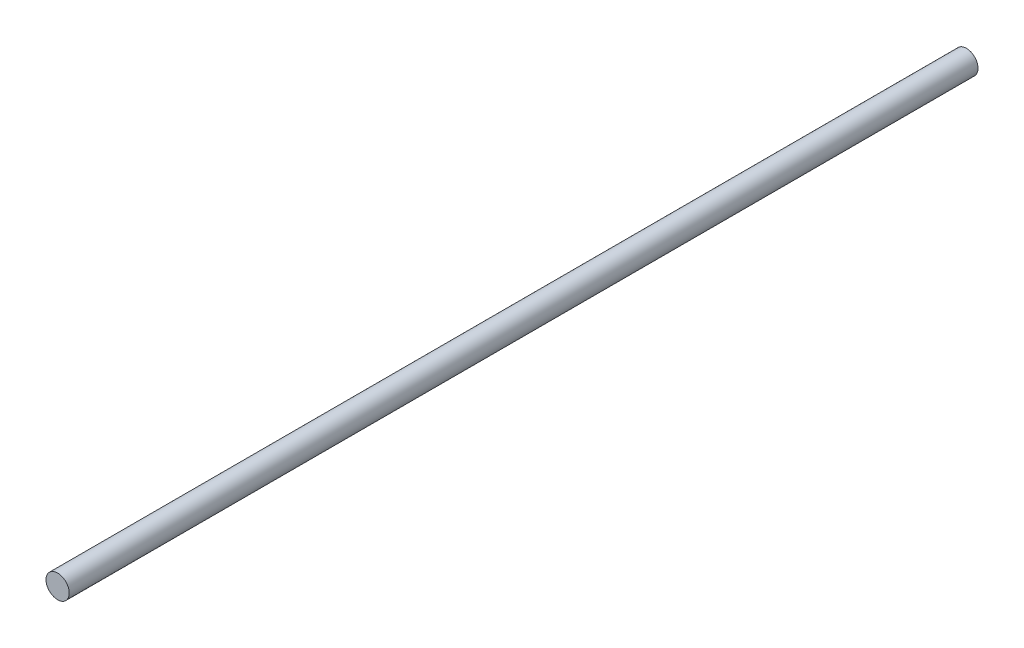
from build123d import *

# Parameters (mm, degrees)
SKETCH1_R           = 3
BOSS_EXTRUDE1_DEPTH = 235


with BuildPart() as part:
    # Sketch1 → Boss-Extrude1 (new body)
    with BuildSketch(Plane.XY):
        with Locations(Location((0, 0, 0), (0, 0, 180))):
            Circle(SKETCH1_R)
    extrude(amount=BOSS_EXTRUDE1_DEPTH)


solid = part.part
